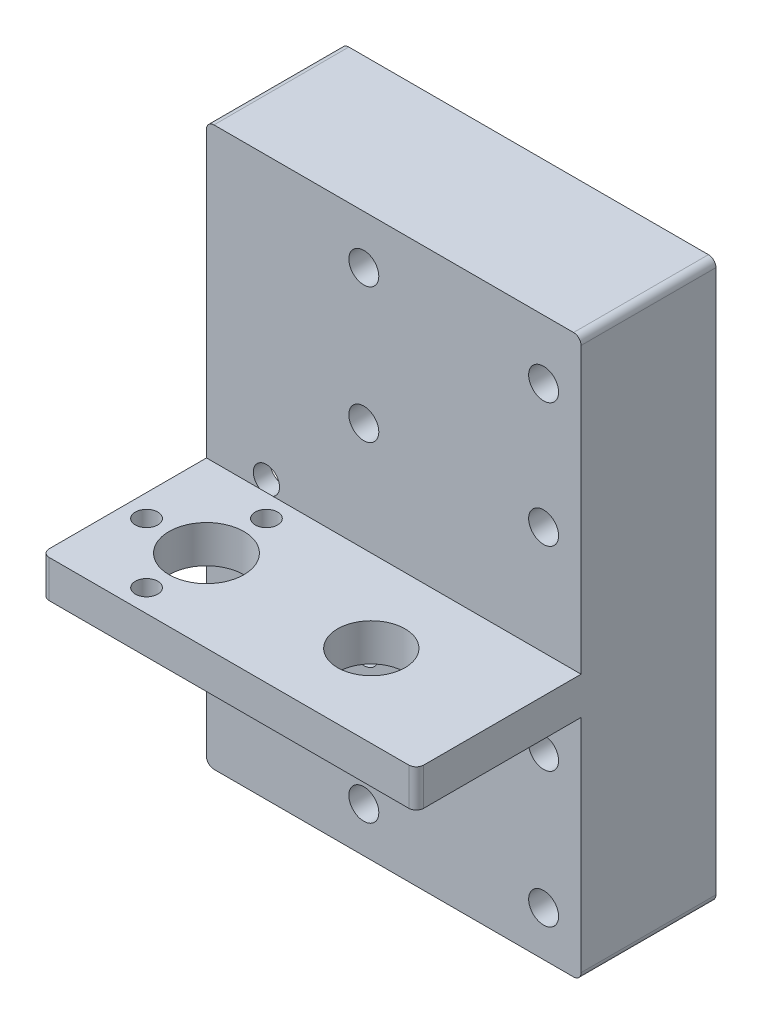
from build123d import *

# Parameters (mm, degrees)
SKETCH1_W           = 50
SKETCH1_H           = 74
SKETCH1_R           = 2
BOSS_EXTRUDE1_DEPTH = 18
SKETCH5_W           = 50
SKETCH5_H           = 18
BOSS_EXTRUDE3_DEPTH = 5.5
SKETCH7_W           = 50
SKETCH7_H           = 5
BOSS_EXTRUDE5_DEPTH = 22
CUT_EXTRUDE1_REACH  = 94.441
SKETCH8_R           = 4.5
SKETCH8_R_2         = 5
SKETCH10_R          = 3.95
SKETCH10_W          = 13.5
SKETCH10_H          = 20
CUT_EXTRUDE2_DEPTH  = 20
CUT_EXTRUDE3_REACH  = 55.993
SKETCH11_R          = 1.75
FILLET2_R           = 1
BOSS_EXTRUDE6_START = -44
SKETCH12_R          = 5
SKETCH12_R_2        = 4.5
BOSS_EXTRUDE6_DEPTH = 5
CUT_EXTRUDE4_REACH  = 65.492
FILLET3_R           = 1
CUT_EXTRUDE5_REACH  = 63.205
SKETCH14_R          = 1.5


with BuildPart() as part:
    # Sketch1 → Boss-Extrude1 (new body)
    with BuildSketch(Plane.XY):
        Rectangle(SKETCH1_W, SKETCH1_H)
        with Locations((-4, 31)):
            Circle(SKETCH1_R, mode=Mode.SUBTRACT)
        with Locations((20, 29.6)):
            Circle(SKETCH1_R, mode=Mode.SUBTRACT)
        with Locations((20, 13)):
            Circle(SKETCH1_R, mode=Mode.SUBTRACT)
        with Locations((-4, 13)):
            Circle(SKETCH1_R, mode=Mode.SUBTRACT)
        with Locations((-4, -13)):
            Circle(SKETCH1_R, mode=Mode.SUBTRACT)
        with Locations((20, -13)):
            Circle(SKETCH1_R, mode=Mode.SUBTRACT)
        with Locations((20, -31)):
            Circle(SKETCH1_R, mode=Mode.SUBTRACT)
        with Locations((-4, -31)):
            Circle(SKETCH1_R, mode=Mode.SUBTRACT)
    extrude(amount=BOSS_EXTRUDE1_DEPTH)

    # Sketch5 → Boss-Extrude3 (add)
    with BuildSketch(Plane(origin=(0, 37, 0), x_dir=(1, 0, 0), z_dir=(0, 1, 0))):
        with Locations((0, -9)):
            Rectangle(SKETCH5_W, SKETCH5_H)
    extrude(amount=BOSS_EXTRUDE3_DEPTH)

    # Sketch7 → Boss-Extrude5 (add)
    with BuildSketch(Plane.XY.offset(18)):
        with Locations((0, 40)):
            Rectangle(SKETCH7_W, SKETCH7_H)
    extrude(amount=BOSS_EXTRUDE5_DEPTH)

    # Sketch8 → Cut-Extrude1 (cut, up to next)
    with BuildSketch(Plane(origin=(0, 42.5, 0), x_dir=(1, 0, 0), z_dir=(0, 1, 0)), mode=Mode.PRIVATE) as cut_extrude1_sk1:
        with Locations(Location((8, -29, 0), (0, 0, 270))):
            Circle(SKETCH8_R)
    cut_extrude1_tool1 = extrude(cut_extrude1_sk1.sketch, amount=-CUT_EXTRUDE1_REACH, mode=Mode.PRIVATE) & part.part
    # Sketch8 → Cut-Extrude1 (cut, up to next)
    with BuildSketch(Plane(origin=(0, 42.5, 0), x_dir=(1, 0, 0), z_dir=(0, 1, 0)), mode=Mode.PRIVATE) as cut_extrude1_sk2:
        with Locations(Location((-14, -29, 0), (0, 0, 270))):
            Circle(SKETCH8_R_2)
    cut_extrude1_tool2 = extrude(cut_extrude1_sk2.sketch, amount=-CUT_EXTRUDE1_REACH, mode=Mode.PRIVATE) & part.part
    add(cut_extrude1_tool1.solids().sort_by_distance((8, 42.5, 29))[0], mode=Mode.SUBTRACT)
    add(cut_extrude1_tool2.solids().sort_by_distance((-14, 42.5, 29))[0], mode=Mode.SUBTRACT)

    # Sketch10 → Cut-Extrude2 (cut)
    with BuildSketch(Plane.ZY.offset(25)):
        with Locations((9, 22)):
            Circle(SKETCH10_R)
        with Locations((9, -22)):
            Circle(SKETCH10_R)
        with Locations((9, 0)):
            Rectangle(SKETCH10_W, SKETCH10_H)
    extrude(amount=-CUT_EXTRUDE2_DEPTH, mode=Mode.SUBTRACT)

    # Cut-Extrude3: up to this face of the body (flat: up to its plane)
    cut_extrude3_end = Plane(part.part.faces().sort_by_distance((-0.207576241, 2.825895063, 0))[0])
    # Sketch11 → Cut-Extrude3 (cut, up to the picked face)
    with BuildSketch(Plane.XY.offset(18), mode=Mode.PRIVATE) as cut_extrude3_sk1:
        with Locations(Location((-17, 0, 0), (0, 0, 180))):
            Circle(SKETCH11_R)
    cut_extrude3_tool1 = split(extrude(cut_extrude3_sk1.sketch, amount=-CUT_EXTRUDE3_REACH, mode=Mode.PRIVATE), bisect_by=cut_extrude3_end, keep=Keep.BOTH, mode=Mode.PRIVATE)
    add(cut_extrude3_tool1.solids().sort_by(Axis((-17, 0, 18), (0, 0, -1)))[0], mode=Mode.SUBTRACT)

    # Fillet2
    fillet2_edges = [part.edges().sort_by_distance(p)[0] for p in [
        (25, 42.5, 20),
        (-25, 42.5, 20),
        (25, -37, 9),
        (-25, -37, 9),
    ]]
    fillet(fillet2_edges, radius=FILLET2_R)

    # Sketch12 → Boss-Extrude6 (add)
    with BuildSketch(Plane(origin=(0, 42.5, 0), x_dir=(1, 0, 0), z_dir=(0, 1, 0)).offset(BOSS_EXTRUDE6_START)):
        Polygon((24, -40), (25, -40), (25, -18), (-25, -18), (-25, -40), (-24, -40), align=None)
        with Locations(Location((-14, -29, 0), (0, 0, 270))):
            Circle(SKETCH12_R, mode=Mode.SUBTRACT)
        with Locations(Location((8, -29, 0), (0, 0, 270))):
            Circle(SKETCH12_R_2, mode=Mode.SUBTRACT)
    extrude(amount=-BOSS_EXTRUDE6_DEPTH)

    # Sketch13 → Cut-Extrude4 (cut, up to next)
    with BuildSketch(Plane.XY.offset(40), mode=Mode.PRIVATE) as cut_extrude4_sk1:
        with BuildLine():
            Line((25, 37.5), (25, 41.5))
            ThreePointArc((25, 41.5), (24.707106781, 42.207106781), (24, 42.5))
            Line((24, 42.5), (-24, 42.5))
            ThreePointArc((-24, 42.5), (-24.707106781, 42.207106781), (-25, 41.5))
            Line((-25, 41.5), (-25, 37.5))
            Line((-25, 37.5), (25, 37.5))
        make_face()
    cut_extrude4_tool1 = extrude(cut_extrude4_sk1.sketch, amount=-CUT_EXTRUDE4_REACH, mode=Mode.PRIVATE) & part.part
    add(cut_extrude4_tool1.solids().sort_by_distance((0, 39.996085, 40))[0], mode=Mode.SUBTRACT)

    # Fillet3
    fillet3_edges = [part.edges().sort_by_distance(p)[0] for p in [
        (25, -4, 40),
        (-25, -4, 40),
        (25, 37.5, 9),
        (-25, 37.5, 9),
    ]]
    fillet(fillet3_edges, radius=FILLET3_R)

    # Sketch14 → Cut-Extrude5 (cut, up to next)
    with BuildSketch(Plane(origin=(0, -1.5, 0), x_dir=(1, 0, 0), z_dir=(0, 1, 0)), mode=Mode.PRIVATE) as cut_extrude5_sk1:
        with Locations(Location((-14, -21, 0), (0, 0, 270))):
            Circle(SKETCH14_R)
    cut_extrude5_tool1 = extrude(cut_extrude5_sk1.sketch, amount=-CUT_EXTRUDE5_REACH, mode=Mode.PRIVATE) & part.part
    # Sketch14 → Cut-Extrude5 (cut, up to next)
    with BuildSketch(Plane(origin=(0, -1.5, 0), x_dir=(1, 0, 0), z_dir=(0, 1, 0)), mode=Mode.PRIVATE) as cut_extrude5_sk2:
        with Locations(Location((-22, -29, 0), (0, 0, 270))):
            Circle(SKETCH14_R)
    cut_extrude5_tool2 = extrude(cut_extrude5_sk2.sketch, amount=-CUT_EXTRUDE5_REACH, mode=Mode.PRIVATE) & part.part
    # Sketch14 → Cut-Extrude5 (cut, up to next)
    with BuildSketch(Plane(origin=(0, -1.5, 0), x_dir=(1, 0, 0), z_dir=(0, 1, 0)), mode=Mode.PRIVATE) as cut_extrude5_sk3:
        with Locations(Location((-14, -37, 0), (0, 0, 270))):
            Circle(SKETCH14_R)
    cut_extrude5_tool3 = extrude(cut_extrude5_sk3.sketch, amount=-CUT_EXTRUDE5_REACH, mode=Mode.PRIVATE) & part.part
    add(cut_extrude5_tool1.solids().sort_by_distance((-14, -1.5, 21))[0], mode=Mode.SUBTRACT)
    add(cut_extrude5_tool2.solids().sort_by_distance((-22, -1.5, 29))[0], mode=Mode.SUBTRACT)
    add(cut_extrude5_tool3.solids().sort_by_distance((-14, -1.5, 37))[0], mode=Mode.SUBTRACT)


solid = part.part
